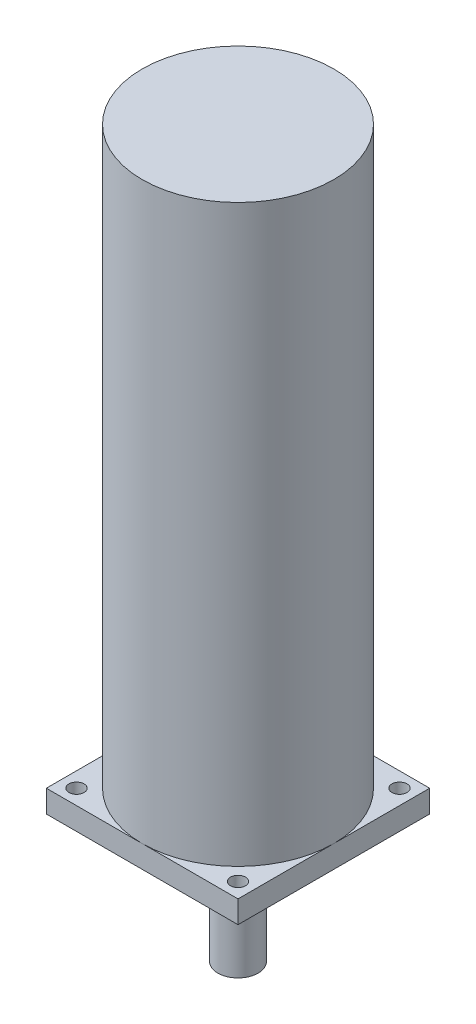
from build123d import *

# Parameters (mm, degrees)
SKETCH1_W           = 38.1
SKETCH1_H           = 38.1
SKETCH1_R           = 1.499997
BOSS_EXTRUDE1_DEPTH = 4.445
SKETCH2_R           = 19.05
BOSS_EXTRUDE2_DEPTH = 114.3
SKETCH3_R           = 4
BOSS_EXTRUDE3_DEPTH = 25.4


with BuildPart() as part:
    # Sketch1 → Boss-Extrude1 (new body)
    with BuildSketch(Plane(origin=(0, 0, 0), x_dir=(1, 0, 0), z_dir=(0, 1, 0))):
        Rectangle(SKETCH1_W, SKETCH1_H)
        with Locations(Location((-16.050006, 16.050006, 0), (0, 0, 270))):
            Circle(SKETCH1_R, mode=Mode.SUBTRACT)
        with Locations(Location((16.050006, 16.050006, 0), (0, 0, 90))):
            Circle(SKETCH1_R, mode=Mode.SUBTRACT)
        with Locations(Location((16.050006, -16.050006, 0), (0, 0, 270))):
            Circle(SKETCH1_R, mode=Mode.SUBTRACT)
        with Locations(Location((-16.050006, -16.050006, 0), (0, 0, 90))):
            Circle(SKETCH1_R, mode=Mode.SUBTRACT)
    extrude(amount=BOSS_EXTRUDE1_DEPTH)

    # Sketch2 → Boss-Extrude2 (add)
    with BuildSketch(Plane(origin=(0, 4.445, 0), x_dir=(1, 0, 0), z_dir=(0, 1, 0))):
        with Locations(Location((0, 0, 0), (0, 0, 270))):
            Circle(SKETCH2_R)
    extrude(amount=BOSS_EXTRUDE2_DEPTH)

    # Sketch3 → Boss-Extrude3 (add)
    with BuildSketch(Plane.XZ):
        with Locations(Location((0, 0, 0), (0, 0, 270))):
            Circle(SKETCH3_R)
    extrude(amount=BOSS_EXTRUDE3_DEPTH)


solid = part.part
